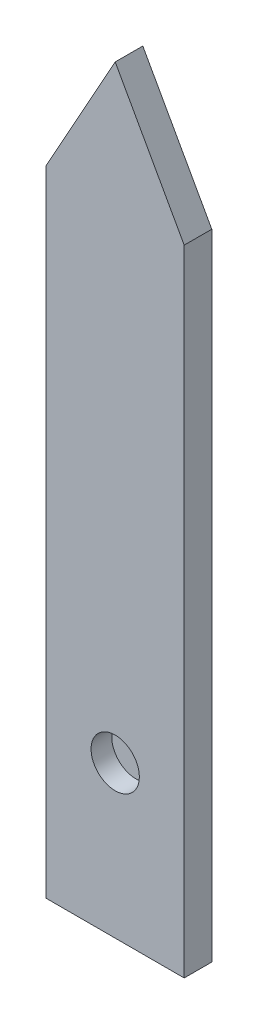
from build123d import *

# Parameters (mm, degrees)
AUFSATZ_LINEAR_AUSTRAGEN1_DEPTH = 4
SKIZZE3_R                       = 3.5
SCHNITT_LINEAR_AUSTRAGEN1_DEPTH = 3


with BuildPart() as part:
    # Skizze1 → Aufsatz-Linear austragen1 (new body)
    with BuildSketch(Plane.XY):
        Polygon((0, 0), (20, 0), (20, 92), (10, 110), (0, 92), align=None)
    extrude(amount=AUFSATZ_LINEAR_AUSTRAGEN1_DEPTH)

    # Skizze3 → Schnitt-Linear austragen1 (cut)
    with BuildSketch(Plane.XY.offset(4)):
        with Locations((10, 22)):
            Circle(SKIZZE3_R)
    extrude(amount=-SCHNITT_LINEAR_AUSTRAGEN1_DEPTH, mode=Mode.SUBTRACT)


solid = part.part
